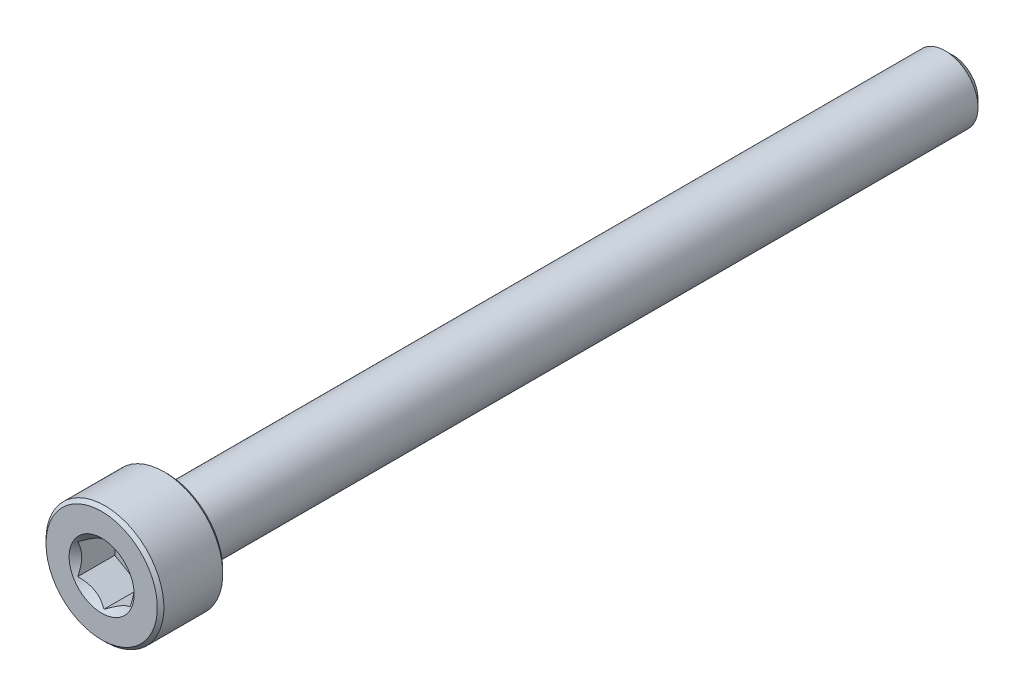
from build123d import *

# Parameters (mm, degrees)
CUT_EXTRUDE1_DEPTH = 1.5


with BuildPart() as part:
    # Sketch2 → Revolve1 (revolve)
    with BuildSketch(Plane(origin=(0, 0, 0), x_dir=(0, 0, -1), z_dir=(1, 0, 0)), mode=Mode.PRIVATE) as revolve1_sk:
        with BuildLine():
            Line((-16.25, 0), (-16.25, 2.125))
            Line((-16.25, 2.125), (-16.125, 2.25))
            Line((-16.125, 2.25), (-13.875, 2.25))
            Line((-13.875, 2.25), (-13.75, 2.125))
            Line((-13.75, 2.125), (-13.75, 1.375))
            ThreePointArc((-13.75, 1.375), (-13.713388348, 1.286611652), (-13.625, 1.25))
            Line((-13.625, 1.25), (15.957716426, 1.25))
            Line((15.957716426, 1.25), (16.25, 0.957716426))
            Line((16.25, 0.957716426), (16.25, 0))
            Line((16.25, 0), (-16.25, 0))
        make_face()
    revolve(revolve1_sk.sketch.rotate(Axis((0, 0, -16.25), (0, 0, 1)), 90), axis=Axis((0, 0, -16.25), (0, 0, 1)))

    # Sketch3 → Cut-Extrude1 (cut)
    with BuildSketch(Plane.XY.offset(16.25)):
        Polygon((1, -0.577350269), (1, 0.577350269), (0, 1.154700538), (-1, 0.577350269), (-1, -0.577350269), (0, -1.154700538), align=None)
    extrude(amount=-CUT_EXTRUDE1_DEPTH, mode=Mode.SUBTRACT)

    # Cut-Extrude2 cone 1 section (through the dimple's axis) → Cut-Extrude2 (revolve, cut)
    with BuildSketch(Plane(origin=(0, 0, 16.25), x_dir=(0, -1, 0), z_dir=(1, 0, 0))):
        Polygon((0, 0), (1.241303079, 0), (0, 1.241303079), align=None)
    revolve(axis=Axis((0, 0, 16.25), (0, 0, -1)), mode=Mode.SUBTRACT)


solid = part.part
